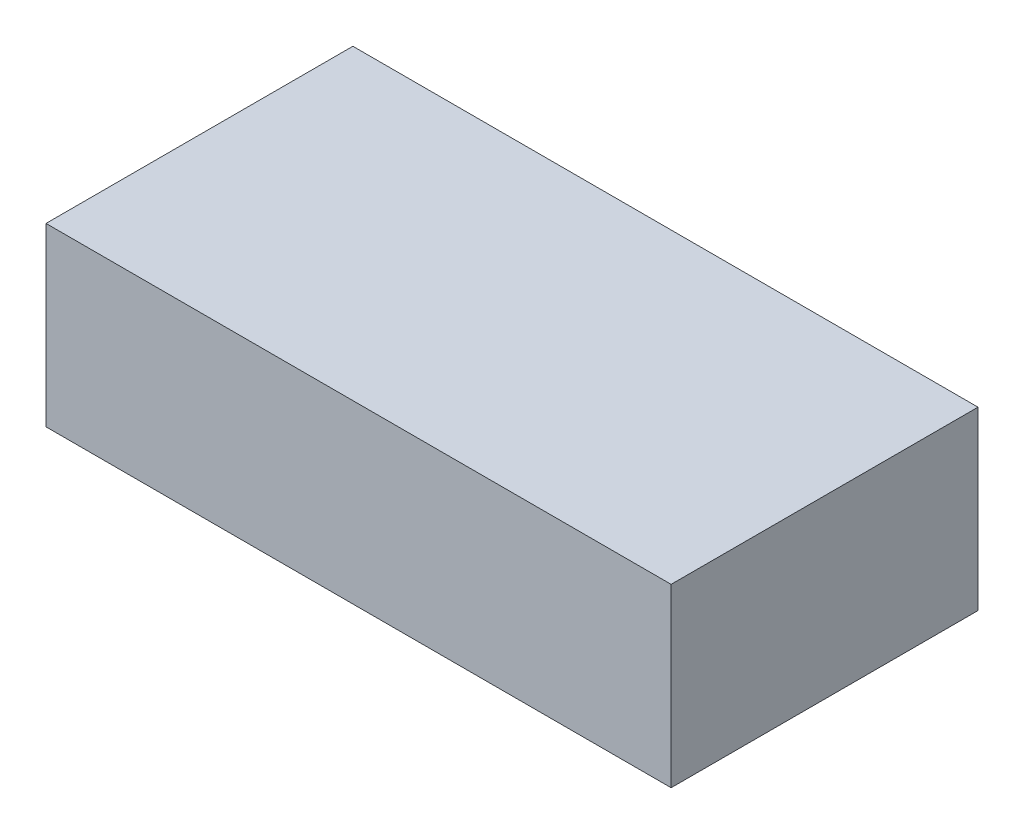
from build123d import *

# Parameters (mm, degrees)
SZKIC1_W                    = 220
SZKIC1_H                    = 108
DODANIE_WYCI_GNI_CIE1_DEPTH = 62
SZKIC2_W                    = 24.7
SZKIC2_H                    = 20
SZKIC2_W_2                  = 50
SZKIC2_H_2                  = 50
DODANIE_WYCI_GNI_CIE2_DEPTH = 0.5


with BuildPart() as part:
    # Szkic1 → Dodanie-wyciągnięcie1 (new body)
    with BuildSketch(Plane(origin=(0, 0, 0), x_dir=(1, 0, 0), z_dir=(0, 1, 0))):
        Rectangle(SZKIC1_W, SZKIC1_H)
    extrude(amount=DODANIE_WYCI_GNI_CIE1_DEPTH)

    # Szkic2 → Dodanie-wyciągnięcie2 (add)
    with BuildSketch(Plane.ZY.offset(110)):
        with Locations((-36.65, 47)):
            Rectangle(SZKIC2_W, SZKIC2_H)
        with Locations((22, 31)):
            Rectangle(SZKIC2_W_2, SZKIC2_H_2)
    extrude(amount=DODANIE_WYCI_GNI_CIE2_DEPTH)


solid = part.part
